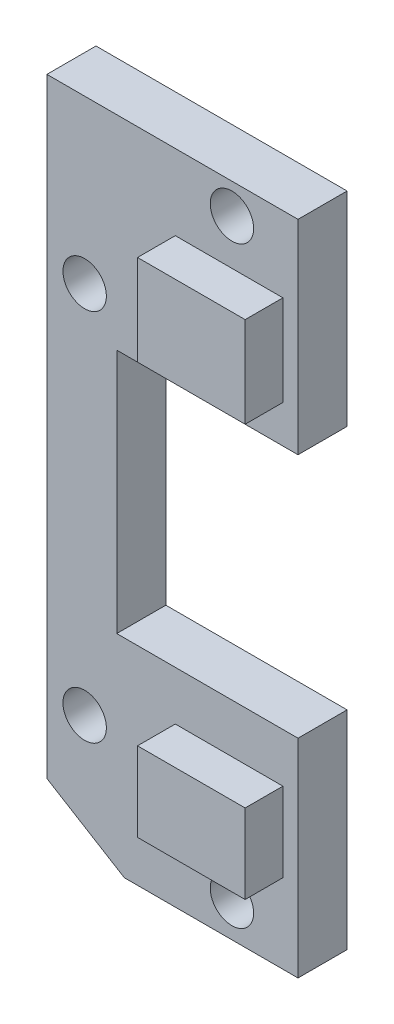
from build123d import *

# Parameters (mm, degrees)
USB_END_CROSSBAR_WITH_OPEN_CONNECTOR_2_R       = 1.15
USB_END_CROSSBAR_WITH_OPEN_CONNECTOR_REL_DEPTH = 2.6
TWO_START                                      = 2.6
TWO_PCB_RESTS_BESIDE_TYPE_C_NO_SUPP_2_W        = 5.7
TWO_PCB_RESTS_BESIDE_TYPE_C_NO_SUPP_2_H        = 4.2
TWO_PCB_RESTS_BESIDE_TYPE_C_NO_SUPP_2_H_2      = 4.8
TWO_PCB_RESTS_BESIDE_TYPE_C_NO_SUPPORT_DEPTH   = 2


with BuildPart() as part:
    # USB end crossbar with open connector 2 → USB end crossbar with open connector rel (new body)
    with BuildSketch(Plane.XY):
        Polygon((-38.8, -21.5), (-34.7, -24), (-25.5, -24), (-25.5, -13), (-35.1, -13), (-35.1, 0), (-25.5, 0), (-25.5, 10.8), (-38.8, 10.8), align=None)
        with Locations((-36.8, -17.6)):
            Circle(USB_END_CROSSBAR_WITH_OPEN_CONNECTOR_2_R, mode=Mode.SUBTRACT)
        with Locations((-36.8, 2.2)):
            Circle(USB_END_CROSSBAR_WITH_OPEN_CONNECTOR_2_R, mode=Mode.SUBTRACT)
        with Locations((-29, -22.2)):
            Circle(USB_END_CROSSBAR_WITH_OPEN_CONNECTOR_2_R, mode=Mode.SUBTRACT)
        with Locations((-29, 9.2)):
            Circle(USB_END_CROSSBAR_WITH_OPEN_CONNECTOR_2_R, mode=Mode.SUBTRACT)
    extrude(amount=USB_END_CROSSBAR_WITH_OPEN_CONNECTOR_REL_DEPTH)

    # Two PCB rests beside Type-C_ no supp 2 → Two PCB rests beside Type-C_ no support (add)
    with BuildSketch(Plane.XY.offset(TWO_START)):
        with Locations((-29.15, -17.7)):
            Rectangle(TWO_PCB_RESTS_BESIDE_TYPE_C_NO_SUPP_2_W, TWO_PCB_RESTS_BESIDE_TYPE_C_NO_SUPP_2_H)
        with Locations((-29.15, 4.4)):
            Rectangle(TWO_PCB_RESTS_BESIDE_TYPE_C_NO_SUPP_2_W, TWO_PCB_RESTS_BESIDE_TYPE_C_NO_SUPP_2_H_2)
    extrude(amount=TWO_PCB_RESTS_BESIDE_TYPE_C_NO_SUPPORT_DEPTH)


solid = part.part
